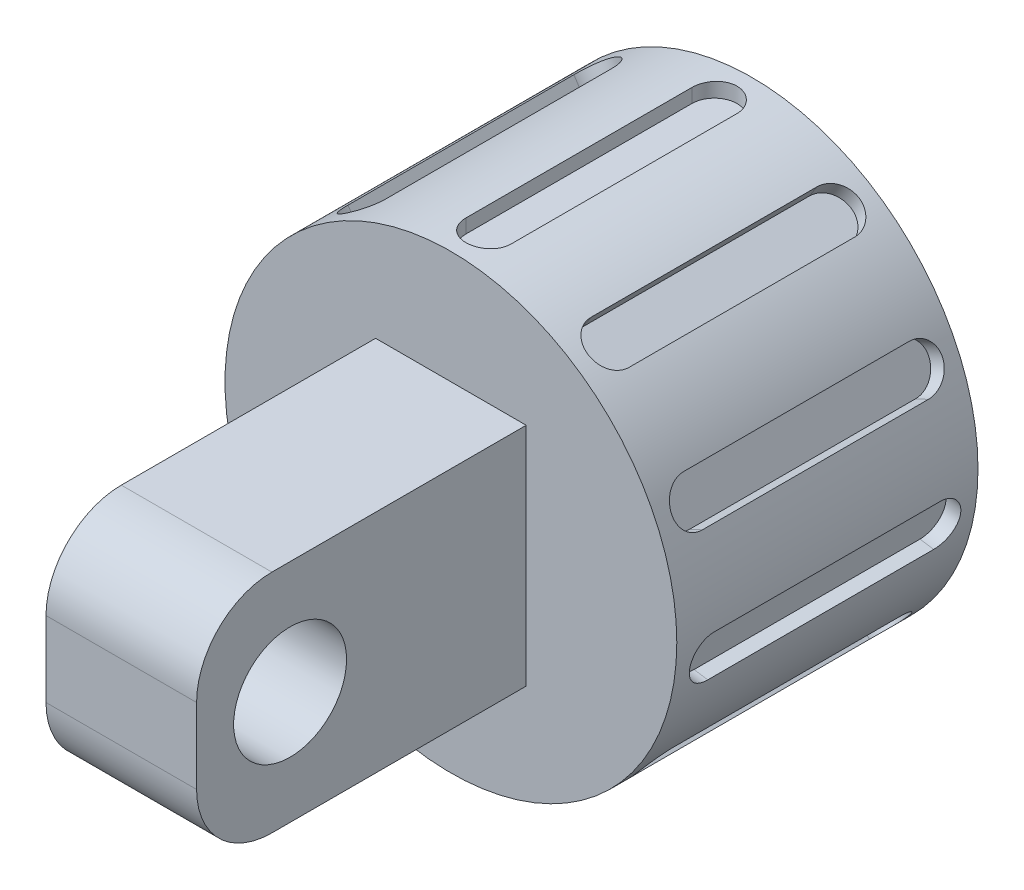
from build123d import *

# Parameters (mm, degrees)
SKETCH1_R               = 30
BOSS_EXTRUDE1_DEPTH     = 20
SKETCH2_W               = 43.772926879
SKETCH2_H               = 30
BOSS_EXTRUDE2_DEPTH     = 10
FILLET1_R               = 10
CUT_EXTRUDE1_DEPTH      = 82.036943444
CUT_EXTRUDE1_DEPTH_BACK = 82.036943444
SKETCH3_R               = 7.5
CUT_EXTRUDE2_START      = 28
CUT_EXTRUDE2_DEPTH      = 20
CIRPATTERN1_COUNT       = 11
SKETCH5_R               = 15
CUT_EXTRUDE3_DEPTH      = 11.5


with BuildPart() as part:
    # Sketch1 → Boss-Extrude1 (new, symmetric)
    with BuildSketch(Plane.XY):
        Circle(SKETCH1_R)
    extrude(amount=BOSS_EXTRUDE1_DEPTH, both=True)

    # Sketch2 → Boss-Extrude2 (add, symmetric)
    with BuildSketch(Plane(origin=(0, 0, 0), x_dir=(0, 0, -1), z_dir=(1, 0, 0))):
        with Locations((-41.88646344, 0)):
            Rectangle(SKETCH2_W, SKETCH2_H)
    extrude(amount=BOSS_EXTRUDE2_DEPTH, both=True)

    # Fillet1
    fillet1_edges = [part.edges().sort_by_distance(p)[0] for p in [
        (0, 15, 63.772926879),
        (0, -15, 63.772926879),
    ]]
    fillet(fillet1_edges, radius=FILLET1_R)

    # Sketch3 → Cut-Extrude1 (cut, two sides: drawn at the far end of the back side and taken through both)
    with BuildSketch(Plane(origin=(10, 0, 0), x_dir=(0, 0, -1), z_dir=(1, 0, 0)).offset(-CUT_EXTRUDE1_DEPTH_BACK)):
        with Locations((-51.35721853, 0)):
            Circle(SKETCH3_R)
    extrude(amount=CUT_EXTRUDE1_DEPTH + CUT_EXTRUDE1_DEPTH_BACK, mode=Mode.SUBTRACT)

    # Sketch4 → Cut-Extrude2 (cut)
    with BuildSketch(Plane(origin=(0, 0, 0), x_dir=(1, 0, 0), z_dir=(0, 1, 0)).offset(CUT_EXTRUDE2_START)):
        with BuildLine():
            Line((3, 15), (3, -15))
            ThreePointArc((3, -15), (0, -18), (-3, -15))
            Line((-3, -15), (-3, 15))
            ThreePointArc((-3, 15), (0, 18), (3, 15))
        make_face()
    cut_extrude2 = extrude(amount=CUT_EXTRUDE2_DEPTH, mode=Mode.SUBTRACT)

    # CirPattern1: Cut-Extrude2 ×11 about axis
    cirpattern1_axis = Axis((0, 0, 0), (0, 0, 1))
    for i in range(1, CIRPATTERN1_COUNT):
        add(cut_extrude2.rotate(cirpattern1_axis, i * 360 / CIRPATTERN1_COUNT), mode=Mode.SUBTRACT)

    # Sketch5 → Cut-Extrude3 (cut)
    with BuildSketch(Plane(origin=(0, 0, -20), x_dir=(-1, 0, 0), z_dir=(0, 0, -1))):
        Circle(SKETCH5_R)
    extrude(amount=-CUT_EXTRUDE3_DEPTH, mode=Mode.SUBTRACT)


solid = part.part
